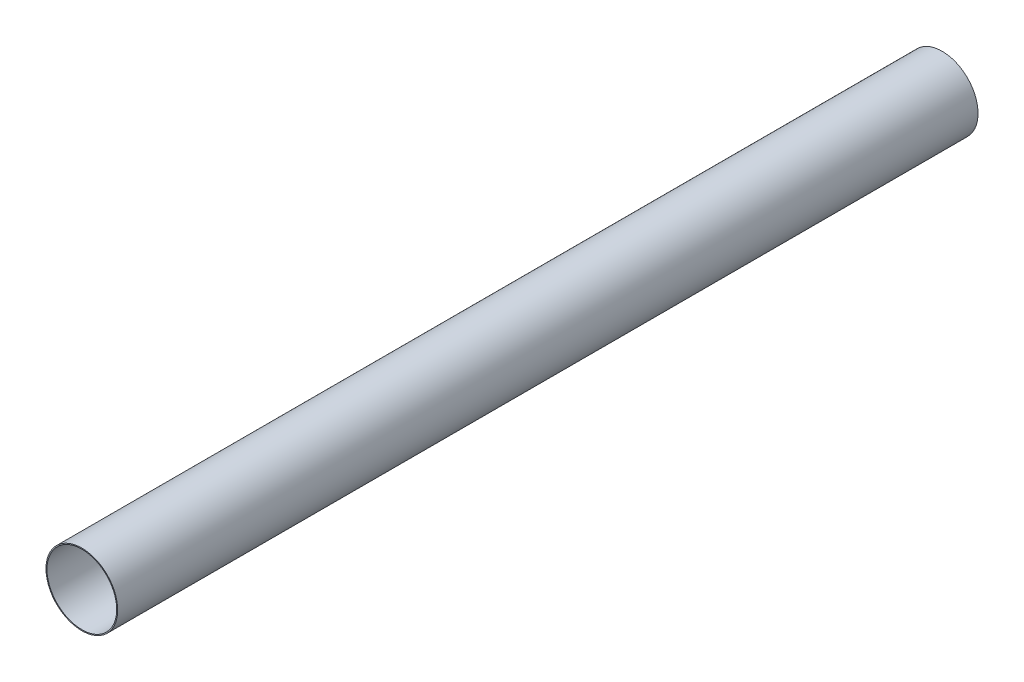
from build123d import *

# Parameters (mm, degrees)
ESQUISSE1_R        = 50.8
ESQUISSE1_R_2      = 49.403
BOSS_EXTRU_1_DEPTH = 1219.2


with BuildPart() as part:
    # Esquisse1 → Boss.-Extru.1 (new body)
    with BuildSketch(Plane.XY):
        with Locations(Location((0, 0, 0), (0, 0, 180))):
            Circle(ESQUISSE1_R)
        with Locations(Location((0, 0, 0), (0, 0, 180))):
            Circle(ESQUISSE1_R_2, mode=Mode.SUBTRACT)
    extrude(amount=BOSS_EXTRU_1_DEPTH)


solid = part.part
